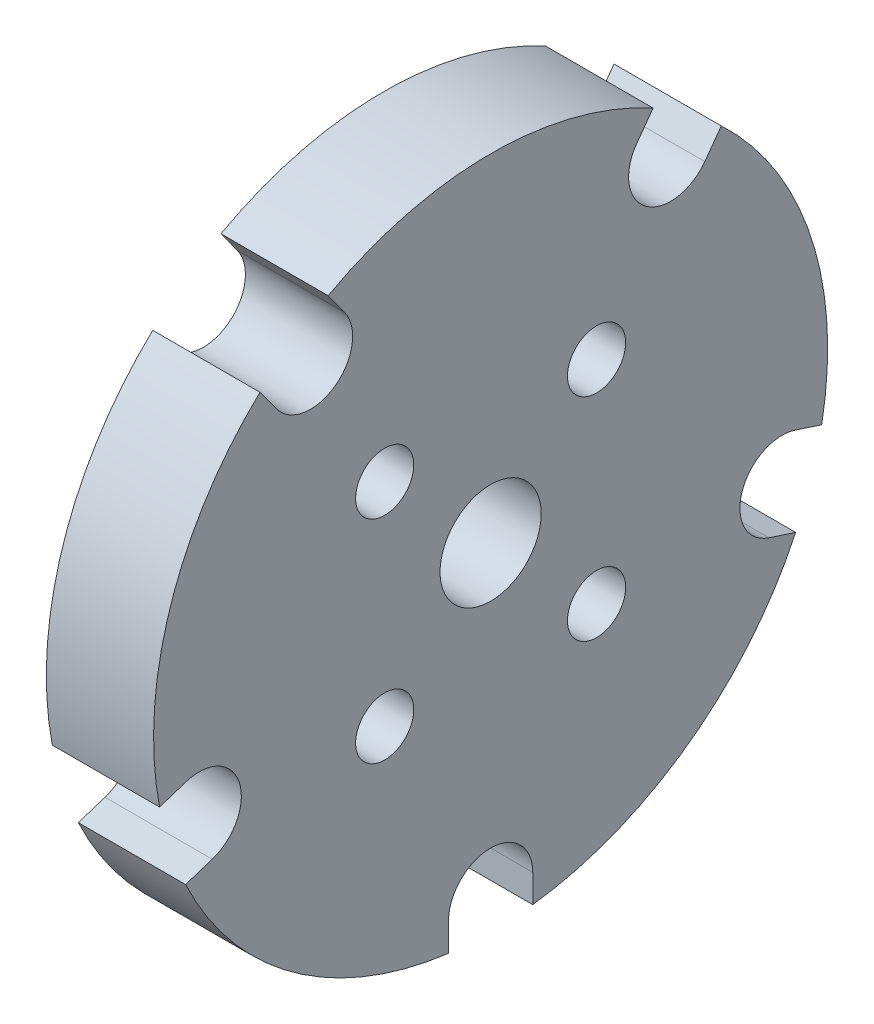
from build123d import *

# Parameters (mm, degrees)
ESQUISSE1_R                                      = 22
BOSS_EXTRU_1_DEPTH                               = 7
ENL_V_MAT_EXTRU_1_REACH                          = 33.89
R_P_TITION_CIRCULAIRE1_COUNT                     = 5
ENL_V_MAT_EXTRU_2_REACH                          = 33.89
ESQUISSE6_R                                      = 3.3
CHAMBRAGE_POUR_VIS_T_TE_RONDE_BOMB_E_D           = 3.7973
CHAMBRAGE_POUR_VIS_T_TE_RONDE_BOMB_E_CBORE_D     = 7.54126
CHAMBRAGE_POUR_VIS_T_TE_RONDE_BOMB_E_CBORE_DEPTH = 2.4638


with BuildPart() as part:
    # Esquisse1 → Boss.-Extru.1 (new body)
    with BuildSketch(Plane(origin=(0, 0, 0), x_dir=(0, 0, -1), z_dir=(1, 0, 0))):
        Circle(ESQUISSE1_R)
    extrude(amount=BOSS_EXTRU_1_DEPTH)

    # Esquisse5 → Enlèv. mat.-Extru.1 (cut, up to next)
    with BuildSketch(Plane(origin=(7, 0, 0), x_dir=(0, 0, -1), z_dir=(1, 0, 0)), mode=Mode.PRIVATE) as enl_v_mat_extru_1_sk1:
        with BuildLine():
            Line((2.75, -20), (2.75, -24))
            ThreePointArc((2.75, -24), (0, -26.75), (-2.75, -24))
            Line((-2.75, -24), (-2.75, -20))
            ThreePointArc((-2.75, -20), (0, -17.25), (2.75, -20))
        make_face()
    enl_v_mat_extru_1_tool1 = extrude(enl_v_mat_extru_1_sk1.sketch, amount=-ENL_V_MAT_EXTRU_1_REACH, mode=Mode.PRIVATE) & part.part
    enl_v_mat_extru_1 = enl_v_mat_extru_1_tool1.solids().sort_by_distance((7, -22, 0))[0]
    add(enl_v_mat_extru_1, mode=Mode.SUBTRACT)

    # Répétition circulaire1: Enlèv. mat.-Extru.1 ×5 about axis
    r_p_tition_circulaire1_axis = Axis((0, 0, 0), (1, 0, 0))
    for i in range(1, R_P_TITION_CIRCULAIRE1_COUNT):
        add(enl_v_mat_extru_1.rotate(r_p_tition_circulaire1_axis, i * 360 / R_P_TITION_CIRCULAIRE1_COUNT), mode=Mode.SUBTRACT)

    # Esquisse6 → Enlèv. mat.-Extru.2 (cut, up to next)
    with BuildSketch(Plane(origin=(7, 0, 0), x_dir=(0, 0, -1), z_dir=(1, 0, 0)), mode=Mode.PRIVATE) as enl_v_mat_extru_2_sk1:
        Circle(ESQUISSE6_R)
    enl_v_mat_extru_2_tool1 = extrude(enl_v_mat_extru_2_sk1.sketch, amount=-ENL_V_MAT_EXTRU_2_REACH, mode=Mode.PRIVATE) & part.part
    add(enl_v_mat_extru_2_tool1.solids().sort_by_distance((7, 0, 0))[0], mode=Mode.SUBTRACT)

    # Chambrage pour vis à tête ronde bombée #61 (through all)
    with Locations(Plane.ZY):
        with Locations((-6.914797213, 6.914797213), (6.914797213, 6.914797213), (6.914797213, -6.914797213), (-6.914797213, -6.914797213)):
            CounterBoreHole(CHAMBRAGE_POUR_VIS_T_TE_RONDE_BOMB_E_D / 2, CHAMBRAGE_POUR_VIS_T_TE_RONDE_BOMB_E_CBORE_D / 2, CHAMBRAGE_POUR_VIS_T_TE_RONDE_BOMB_E_CBORE_DEPTH)


solid = part.part
